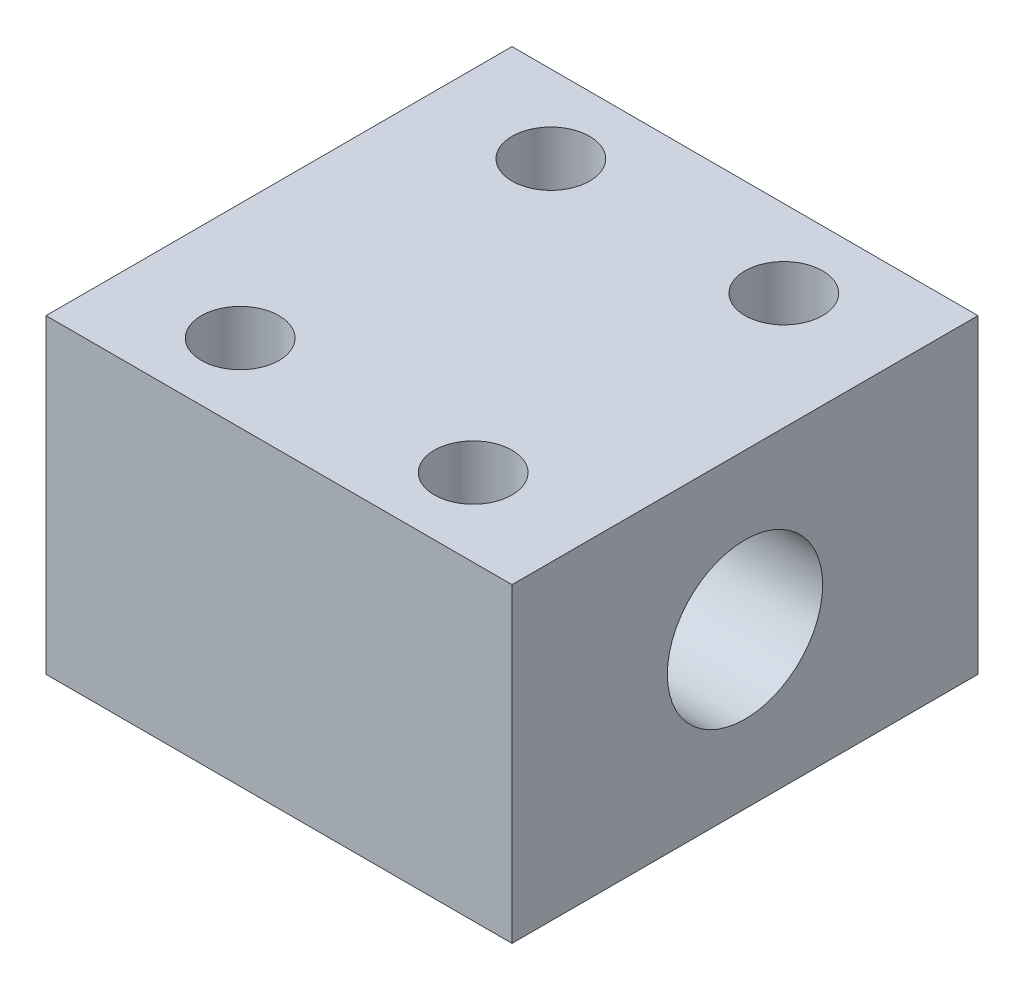
from build123d import *

# Parameters (mm, degrees)
SKETCH1_W           = 38.1
SKETCH1_H           = 38.1
SKETCH1_R           = 3.175
BOSS_EXTRUDE1_DEPTH = 25.4
SKETCH2_R           = 6.35
CUT_EXTRUDE1_DEPTH  = 50.595085442


with BuildPart() as part:
    # Sketch1 → Boss-Extrude1 (new body)
    with BuildSketch(Plane(origin=(0, 0, 0), x_dir=(1, 0, 0), z_dir=(0, 1, 0))):
        Rectangle(SKETCH1_W, SKETCH1_H)
        with Locations(Location((-9.525, 12.7, 0), (0, 0, 270))):
            Circle(SKETCH1_R, mode=Mode.SUBTRACT)
        with Locations(Location((9.525, 12.7, 0), (0, 0, 90))):
            Circle(SKETCH1_R, mode=Mode.SUBTRACT)
        with Locations(Location((9.525, -12.7, 0), (0, 0, 270))):
            Circle(SKETCH1_R, mode=Mode.SUBTRACT)
        with Locations(Location((-9.525, -12.7, 0), (0, 0, 90))):
            Circle(SKETCH1_R, mode=Mode.SUBTRACT)
    extrude(amount=BOSS_EXTRUDE1_DEPTH)

    # Sketch2 → Cut-Extrude1 (cut, through all)
    with BuildSketch(Plane(origin=(19.05, 0, 0), x_dir=(0, 0, -1), z_dir=(1, 0, 0))):
        with Locations((0, 12.7)):
            Circle(SKETCH2_R)
    extrude(amount=-CUT_EXTRUDE1_DEPTH, mode=Mode.SUBTRACT)


solid = part.part
